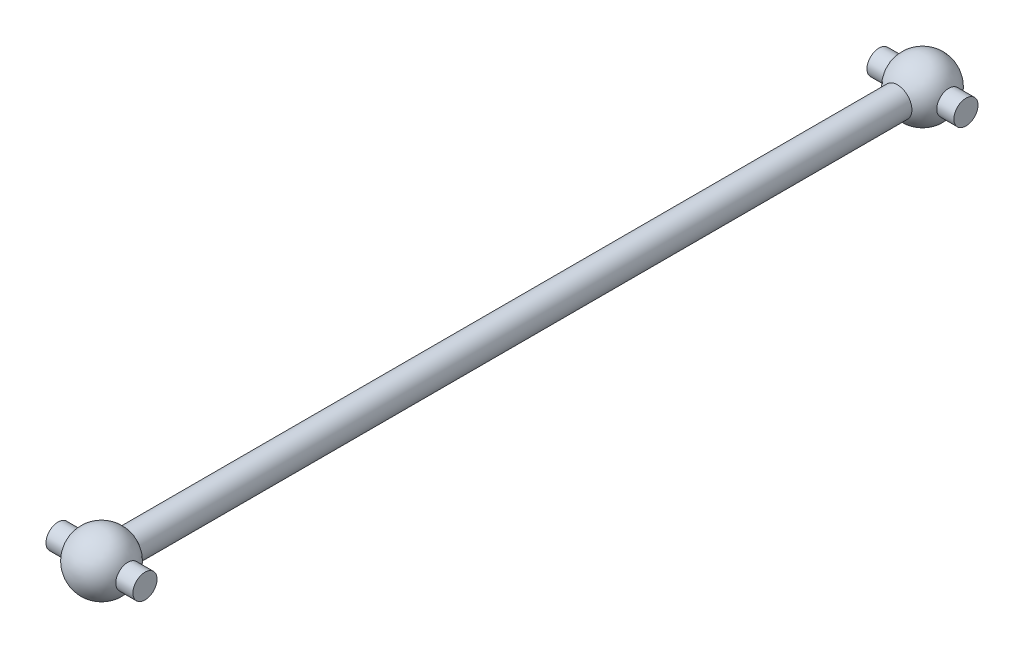
from build123d import *

# Parameters (mm, degrees)
BOSS_EXTRUDE1_DEPTH      = 42.5
BOSS_EXTRUDE1_DEPTH_BACK = 42.5
SKETCH1_R                = 1.5
SKETCH3_R                = 1.25
BOSS_EXTRUDE2_DEPTH      = 4.5


with BuildPart() as part:
    # Sketch1 → Boss-Extrude1 (new, two sides: drawn at the far end of the back side and taken through both)
    with BuildSketch(Plane.XY.offset(-BOSS_EXTRUDE1_DEPTH_BACK)):
        Circle(SKETCH1_R)
    extrude(amount=BOSS_EXTRUDE1_DEPTH + BOSS_EXTRUDE1_DEPTH_BACK)

    # Sketch2 → Revolve1 (revolve)
    with BuildSketch(Plane(origin=(0, 0, 0), x_dir=(0, 0, -1), z_dir=(1, 0, 0))):
        with BuildLine():
            Line((-42.5, -3), (-42.5, 3))
            ThreePointArc((-42.5, 3), (-45.5, 0), (-42.5, -3))
        make_face()
    revolve1 = revolve(axis=Axis((0, 3, 42.5), (0, -1, 0)))

    # Sketch3 → Boss-Extrude2 (add, symmetric)
    with BuildSketch(Plane(origin=(0, 0, 0), x_dir=(0, 0, -1), z_dir=(1, 0, 0))):
        with Locations((-42.5, 0)):
            Circle(SKETCH3_R)
    boss_extrude2 = extrude(amount=BOSS_EXTRUDE2_DEPTH, both=True)

    # Mirror1: Revolve1, Boss-Extrude2 across plane
    add(revolve1.mirror(Plane.XY))
    add(boss_extrude2.mirror(Plane.XY))


solid = part.part
